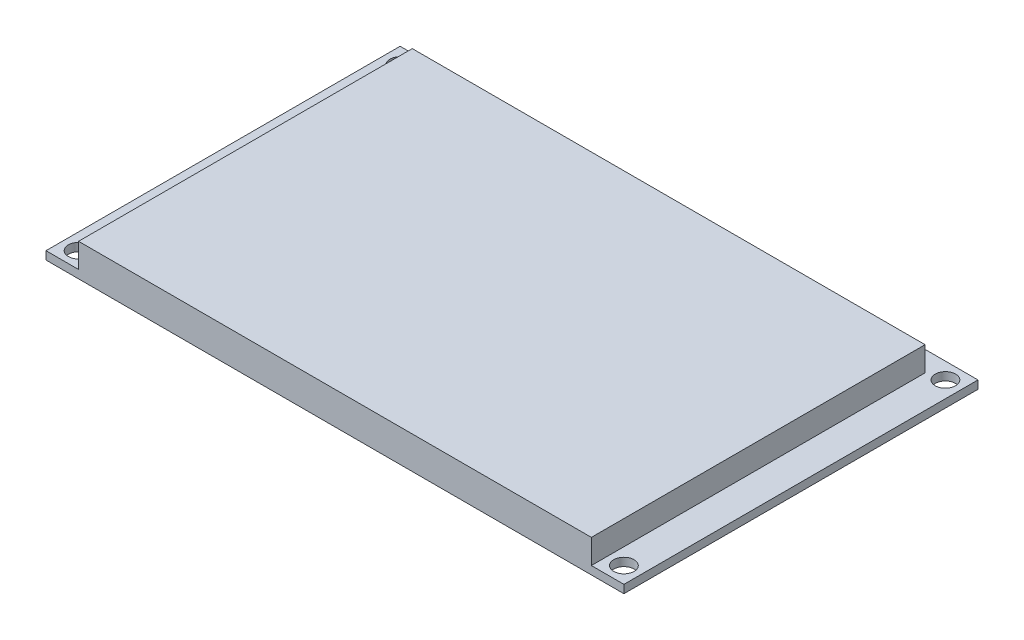
from build123d import *

# Parameters (mm, degrees)
SKETCH_1_W          = 71
SKETCH_1_H          = 43.5
EXTRUDE_1_DEPTH     = 1
CUT_EXTRUDE_1_REACH = 43.645
SKETCH_6_R          = 1.25
SKETCH_4_W          = 63
SKETCH_4_H          = 41
EXTRUDE_2_DEPTH     = 3


with BuildPart() as part:
    # 草图1 → 凸台-拉伸1 (new body)
    with BuildSketch(Plane(origin=(0, 0, 0), x_dir=(1, 0, 0), z_dir=(0, 1, 0))):
        Rectangle(SKETCH_1_W, SKETCH_1_H)
    extrude(amount=EXTRUDE_1_DEPTH)

    # 草图6 → 切除-拉伸1 (cut, up to next)
    with BuildSketch(Plane(origin=(0, 1, 0), x_dir=(1, 0, 0), z_dir=(0, 1, 0)), mode=Mode.PRIVATE) as cut_extrude_1_sk1:
        with Locations(Location((-33.5, 19.75, 0), (0, 0, 270))):
            Circle(SKETCH_6_R)
    cut_extrude_1_tool1 = extrude(cut_extrude_1_sk1.sketch, amount=-CUT_EXTRUDE_1_REACH, mode=Mode.PRIVATE) & part.part
    # 草图6 → 切除-拉伸1 (cut, up to next)
    with BuildSketch(Plane(origin=(0, 1, 0), x_dir=(1, 0, 0), z_dir=(0, 1, 0)), mode=Mode.PRIVATE) as cut_extrude_1_sk2:
        with Locations(Location((33.5, 19.75, 0), (0, 0, 270))):
            Circle(SKETCH_6_R)
    cut_extrude_1_tool2 = extrude(cut_extrude_1_sk2.sketch, amount=-CUT_EXTRUDE_1_REACH, mode=Mode.PRIVATE) & part.part
    # 草图6 → 切除-拉伸1 (cut, up to next)
    with BuildSketch(Plane(origin=(0, 1, 0), x_dir=(1, 0, 0), z_dir=(0, 1, 0)), mode=Mode.PRIVATE) as cut_extrude_1_sk3:
        with Locations(Location((33.5, -19.75, 0), (0, 0, 270))):
            Circle(SKETCH_6_R)
    cut_extrude_1_tool3 = extrude(cut_extrude_1_sk3.sketch, amount=-CUT_EXTRUDE_1_REACH, mode=Mode.PRIVATE) & part.part
    # 草图6 → 切除-拉伸1 (cut, up to next)
    with BuildSketch(Plane(origin=(0, 1, 0), x_dir=(1, 0, 0), z_dir=(0, 1, 0)), mode=Mode.PRIVATE) as cut_extrude_1_sk4:
        with Locations(Location((-33.5, -19.75, 0), (0, 0, 270))):
            Circle(SKETCH_6_R)
    cut_extrude_1_tool4 = extrude(cut_extrude_1_sk4.sketch, amount=-CUT_EXTRUDE_1_REACH, mode=Mode.PRIVATE) & part.part
    add(cut_extrude_1_tool1.solids().sort_by_distance((-33.5, 1, -19.75))[0], mode=Mode.SUBTRACT)
    add(cut_extrude_1_tool2.solids().sort_by_distance((33.5, 1, -19.75))[0], mode=Mode.SUBTRACT)
    add(cut_extrude_1_tool3.solids().sort_by_distance((33.5, 1, 19.75))[0], mode=Mode.SUBTRACT)
    add(cut_extrude_1_tool4.solids().sort_by_distance((-33.5, 1, 19.75))[0], mode=Mode.SUBTRACT)

    # 草图4 → 凸台-拉伸2 (add)
    with BuildSketch(Plane(origin=(0, 1, 0), x_dir=(1, 0, 0), z_dir=(0, 1, 0))):
        with Locations((0, -1.25)):
            Rectangle(SKETCH_4_W, SKETCH_4_H)
    extrude(amount=EXTRUDE_2_DEPTH)


solid = part.part
